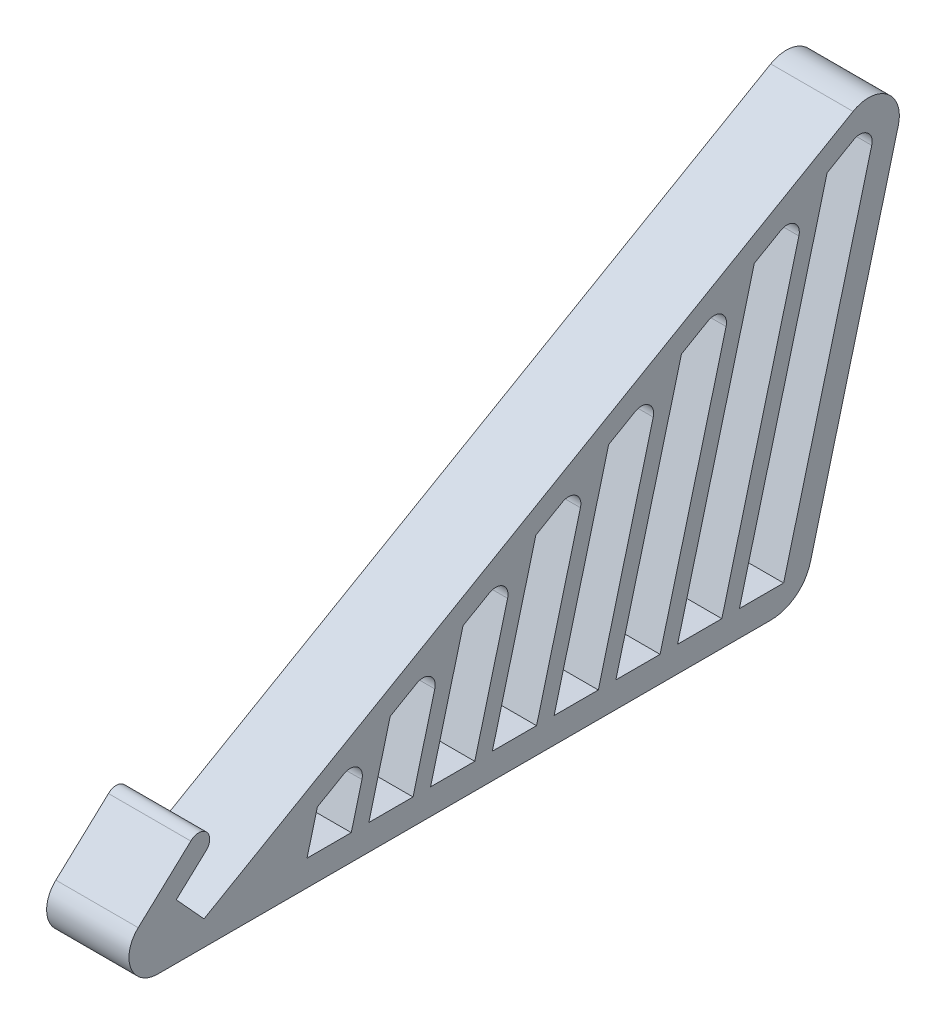
from build123d import *

# Parameters (mm, degrees)
BOSS_EXTRUDE1_DEPTH = 10


with BuildPart() as part:
    # Sketch1 → Boss-Extrude1 (new, symmetric)
    with BuildSketch(Plane(origin=(0, 0, 0), x_dir=(0, 0, -1), z_dir=(1, 0, 0))):
        with BuildLine():
            Line((-99.315402363, -30.342537444), (58.309854952, 60.662447298))
            ThreePointArc((58.309854952, 60.662447298), (66.611935212, 60.127841079), (69.313108369, 52.259295849))
            Line((69.313108369, 52.259295849), (47.967793309, -28.886485338))
            ThreePointArc((47.967793309, -28.886485338), (44.402545097, -34.262116945), (38.296788753, -36.342537444))
            Line((38.296788753, -36.342537444), (-110.536380347, -36.342537444))
            ThreePointArc((-110.536380347, -36.342537444), (-117.053891299, -31.896368093), (-115.29198584, -24.205980582))
            Line((-115.29198584, -24.205980582), (-102.51761164, -12.379014435))
            ThreePointArc((-102.51761164, -12.379014435), (-98.726134685, -12.366723669), (-98.713843919, -16.158200625))
            Line((-98.713843919, -16.158200625), (-106.051782293, -22.951922758))
            Line((-106.051782293, -22.951922758), (-99.315402363, -30.342537444))
        make_face()
        with BuildLine():
            Line((52.017451593, 50.914073792), (30.709901091, -30.088142654))
            Line((30.709901091, -30.088142654), (41.447586102, -30.088142654))
            Line((41.447586102, -30.088142654), (62.847268014, 51.26431811))
            ThreePointArc((62.847268014, 51.26431811), (61.766798752, 54.411736202), (58.445966648, 54.62557869))
            Line((58.445966648, 54.62557869), (52.017451593, 50.914073792))
        make_face(mode=Mode.SUBTRACT)
        with BuildLine():
            Line((15.709901091, -30.088142654), (26.447586102, -30.088142654))
            Line((26.447586102, -30.088142654), (45.161270866, 41.053302896))
            ThreePointArc((45.161270866, 41.053302896), (44.080801604, 44.200720988), (40.7599695, 44.414563475))
            Line((40.7599695, 44.414563475), (34.331454445, 40.703058578))
            Line((34.331454445, 40.703058578), (15.709901091, -30.088142654))
        make_face(mode=Mode.SUBTRACT)
        with BuildLine():
            Line((0.709901092, -30.088142654), (11.447586102, -30.088142654))
            Line((11.447586102, -30.088142654), (27.475273718, 30.842287682))
            ThreePointArc((27.475273718, 30.842287682), (26.394804456, 33.989705774), (23.073972352, 34.203548261))
            Line((23.073972352, 34.203548261), (16.645457297, 30.492043364))
            Line((16.645457297, 30.492043364), (0.709901092, -30.088142654))
        make_face(mode=Mode.SUBTRACT)
        with BuildLine():
            Line((-14.290098908, -30.088142654), (-3.552413898, -30.088142654))
            Line((-3.552413898, -30.088142654), (9.789276571, 20.631272467))
            ThreePointArc((9.789276571, 20.631272467), (8.708807308, 23.778690559), (5.387975204, 23.992533047))
            Line((5.387975204, 23.992533047), (-1.040539851, 20.28102815))
            Line((-1.040539851, 20.28102815), (-14.290098908, -30.088142654))
        make_face(mode=Mode.SUBTRACT)
        with BuildLine():
            Line((-29.290098908, -30.088142654), (-18.552413898, -30.088142654))
            Line((-18.552413898, -30.088142654), (-7.896720577, 10.420257253))
            ThreePointArc((-7.896720577, 10.420257253), (-8.97718984, 13.567675345), (-12.298021944, 13.781517833))
            Line((-12.298021944, 13.781517833), (-18.726536999, 10.070012936))
            Line((-18.726536999, 10.070012936), (-29.290098908, -30.088142654))
        make_face(mode=Mode.SUBTRACT)
        with BuildLine():
            Line((-44.290098908, -30.088142654), (-33.552413898, -30.088142654))
            Line((-33.552413898, -30.088142654), (-25.582717725, 0.209242039))
            ThreePointArc((-25.582717725, 0.209242039), (-26.663186988, 3.356660131), (-29.984019092, 3.570502619))
            Line((-29.984019092, 3.570502619), (-36.412534146, -0.141002279))
            Line((-36.412534146, -0.141002279), (-44.290098908, -30.088142654))
        make_face(mode=Mode.SUBTRACT)
        with BuildLine():
            Line((-59.290098908, -30.088142654), (-48.552413898, -30.088142654))
            Line((-48.552413898, -30.088142654), (-43.268714873, -10.001773175))
            ThreePointArc((-43.268714873, -10.001773175), (-44.349184136, -6.854355083), (-47.67001624, -6.640512596))
            Line((-47.67001624, -6.640512596), (-54.098531294, -10.352017493))
            Line((-54.098531294, -10.352017493), (-59.290098908, -30.088142654))
        make_face(mode=Mode.SUBTRACT)
        with BuildLine():
            Line((-74.290098908, -30.088142654), (-63.552413898, -30.088142654))
            Line((-63.552413898, -30.088142654), (-60.954712021, -20.212788389))
            ThreePointArc((-60.954712021, -20.212788389), (-62.035181283, -17.065370297), (-65.356013388, -16.85152781))
            Line((-65.356013388, -16.85152781), (-71.784528442, -20.563032707))
            Line((-71.784528442, -20.563032707), (-74.290098908, -30.088142654))
        make_face(mode=Mode.SUBTRACT)
    extrude(amount=BOSS_EXTRUDE1_DEPTH, both=True)


solid = part.part
